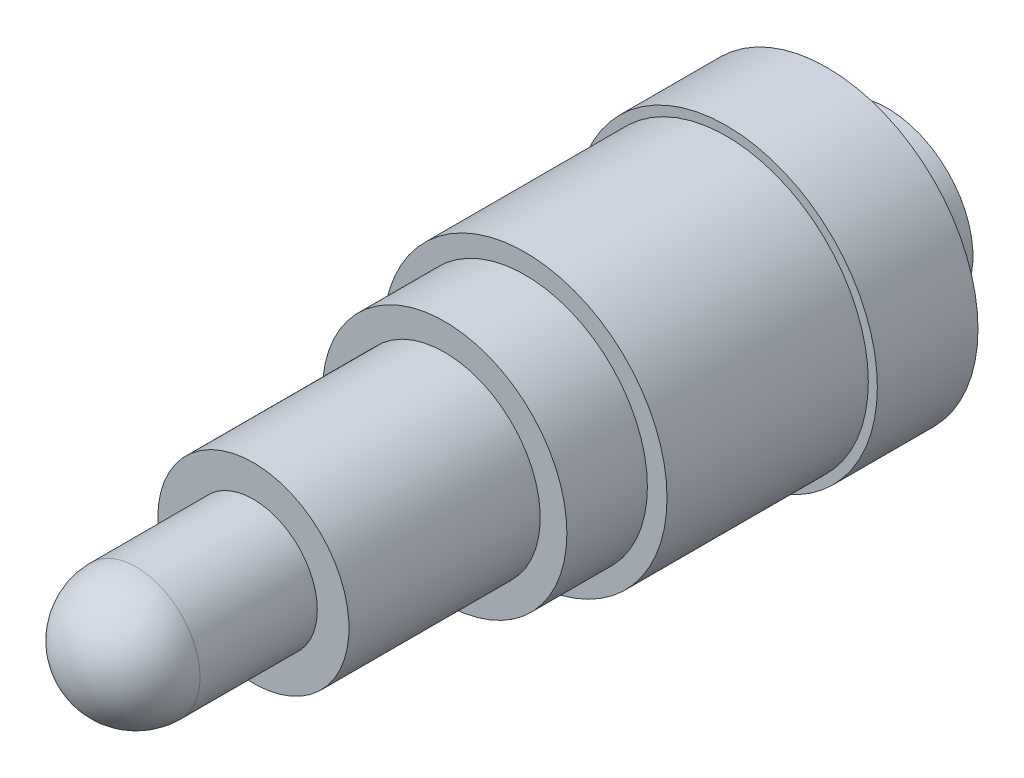
from build123d import *

# Parameters (mm, degrees)
SKETCH1_R           = 3.175
BOSS_EXTRUDE1_DEPTH = 9
SKETCH2_R           = 4.75
BOSS_EXTRUDE2_DEPTH = 9.5
SKETCH3_R           = 6.075
BOSS_EXTRUDE3_DEPTH = 4
SKETCH4_R           = 7.05
BOSS_EXTRUDE4_DEPTH = 10
SKETCH5_R           = 7.5
BOSS_EXTRUDE5_DEPTH = 5
SKETCH6_R           = 4.25
BOSS_EXTRUDE6_DEPTH = 3
FILLET1_R           = 3.175


with BuildPart() as part:
    # Sketch1 → Boss-Extrude1 (new body)
    with BuildSketch(Plane.XY):
        Circle(SKETCH1_R)
    extrude(amount=BOSS_EXTRUDE1_DEPTH)

    # Sketch2 → Boss-Extrude2 (add)
    with BuildSketch(Plane(origin=(0, 0, 0), x_dir=(-1, 0, 0), z_dir=(0, 0, -1))):
        Circle(SKETCH2_R)
    extrude(amount=BOSS_EXTRUDE2_DEPTH)

    # Sketch3 → Boss-Extrude3 (add)
    with BuildSketch(Plane(origin=(0, 0, -9.5), x_dir=(-1, 0, 0), z_dir=(0, 0, -1))):
        Circle(SKETCH3_R)
    extrude(amount=BOSS_EXTRUDE3_DEPTH)

    # Sketch4 → Boss-Extrude4 (add)
    with BuildSketch(Plane(origin=(0, 0, -13.5), x_dir=(-1, 0, 0), z_dir=(0, 0, -1))):
        Circle(SKETCH4_R)
    extrude(amount=BOSS_EXTRUDE4_DEPTH)

    # Sketch5 → Boss-Extrude5 (add)
    with BuildSketch(Plane(origin=(0, 0, -23.5), x_dir=(-1, 0, 0), z_dir=(0, 0, -1))):
        Circle(SKETCH5_R)
    extrude(amount=BOSS_EXTRUDE5_DEPTH)

    # Sketch6 → Boss-Extrude6 (add)
    with BuildSketch(Plane(origin=(0, 0, -28.5), x_dir=(-1, 0, 0), z_dir=(0, 0, -1))):
        Circle(SKETCH6_R)
    extrude(amount=BOSS_EXTRUDE6_DEPTH)

    # Fillet1
    fillet1_edges = [part.edges().sort_by_distance(p)[0] for p in [
        (-3.175, 0, 9),
    ]]
    fillet(fillet1_edges, radius=FILLET1_R)


solid = part.part
